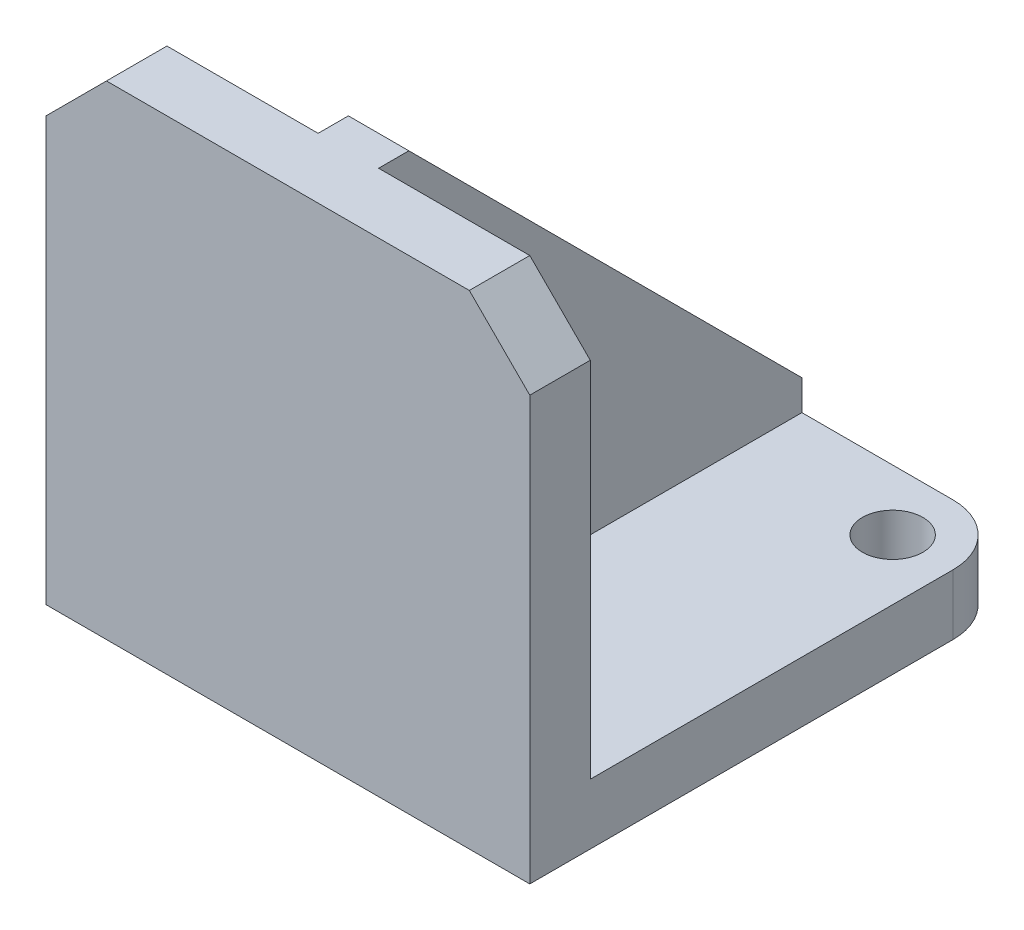
from build123d import *

# Parameters (mm, degrees)
BOSS_EXTRUDE2_DEPTH = 40
BOSS_EXTRUDE3_DEPTH = 5
FILLET1_R           = 10
SKETCH3_R           = 5
CUT_EXTRUDE1_DEPTH  = 114.578166916
CHAMFER1_SIZE       = 10


with BuildPart() as part:
    # Sketch1 → Boss-Extrude2 (new, symmetric)
    with BuildSketch(Plane(origin=(0, 0, 0), x_dir=(0, 0, -1), z_dir=(1, 0, 0))):
        Polygon((0, 0), (80, 0), (80, 10), (10, 10), (10, 80), (0, 80), align=None)
    extrude(amount=BOSS_EXTRUDE2_DEPTH, both=True)

    # Sketch2 → Boss-Extrude3 (add, symmetric)
    with BuildSketch(Plane(origin=(0, 0, 0), x_dir=(0, 0, -1), z_dir=(1, 0, 0))):
        Polygon((10, 10), (80, 10), (80, 15), (15, 80), (10, 80), align=None)
    extrude(amount=BOSS_EXTRUDE3_DEPTH, both=True)

    # Fillet1
    fillet1_edges = [part.edges().sort_by_distance(p)[0] for p in [
        (40, 5, -80),
        (-40, 5, -80),
    ]]
    fillet(fillet1_edges, radius=FILLET1_R)

    # Sketch3 → Cut-Extrude1 (cut, through all)
    with BuildSketch(Plane(origin=(0, 10, 0), x_dir=(1, 0, 0), z_dir=(0, 1, 0))):
        with Locations(Location((30, 70, 0), (0, 0, 270))):
            Circle(SKETCH3_R)
        with Locations(Location((-30, 70, 0), (0, 0, 270))):
            Circle(SKETCH3_R)
    extrude(amount=-CUT_EXTRUDE1_DEPTH, mode=Mode.SUBTRACT)

    # Chamfer1
    chamfer1_edges = [part.edges().sort_by_distance(p)[0] for p in [
        (40, 80, -5),
        (-40, 80, -5),
    ]]
    chamfer(chamfer1_edges, length=CHAMFER1_SIZE)


solid = part.part
